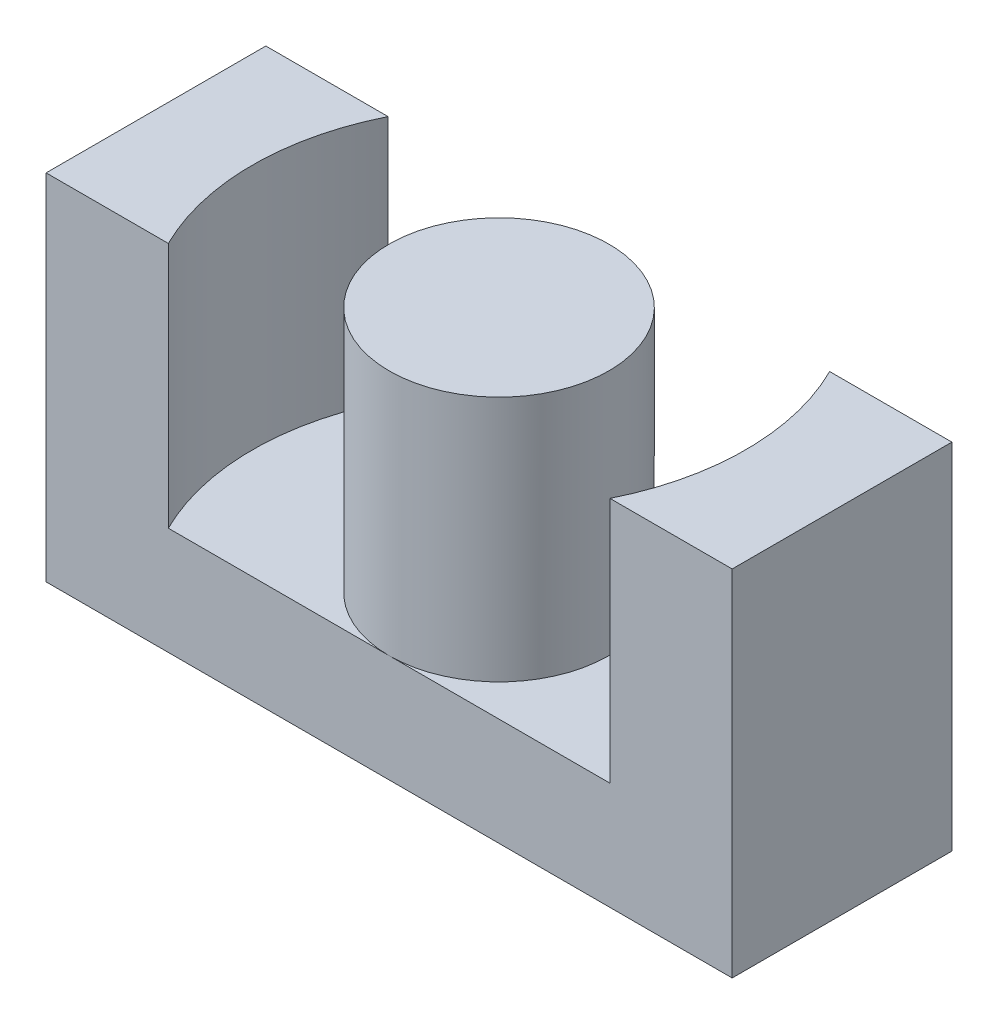
from build123d import *

# Parameters (mm, degrees)
SKETCH1_W          = 30.6
SKETCH1_H          = 9.8
BASE_EXTRUDE_DEPTH = 15.8
SKETCH2_R          = 11
SKETCH2_R_2        = 4.9
CUT_EXTRUDE1_DEPTH = 11


with BuildPart() as part:
    # Sketch1 → Base-Extrude (new body)
    with BuildSketch(Plane(origin=(0, 0, 0), x_dir=(1, 0, 0), z_dir=(0, 1, 0))):
        Rectangle(SKETCH1_W, SKETCH1_H)
    extrude(amount=BASE_EXTRUDE_DEPTH)

    # Sketch2 → Cut-Extrude1 (cut)
    with BuildSketch(Plane(origin=(0, 15.8, 0), x_dir=(-1, 0, 0), z_dir=(0, 1, 0))):
        Circle(SKETCH2_R)
        with Locations(Location((0, 0, 0), (0, 0, 90))):
            Circle(SKETCH2_R_2, mode=Mode.SUBTRACT)
    extrude(amount=-CUT_EXTRUDE1_DEPTH, mode=Mode.SUBTRACT)


solid = part.part
